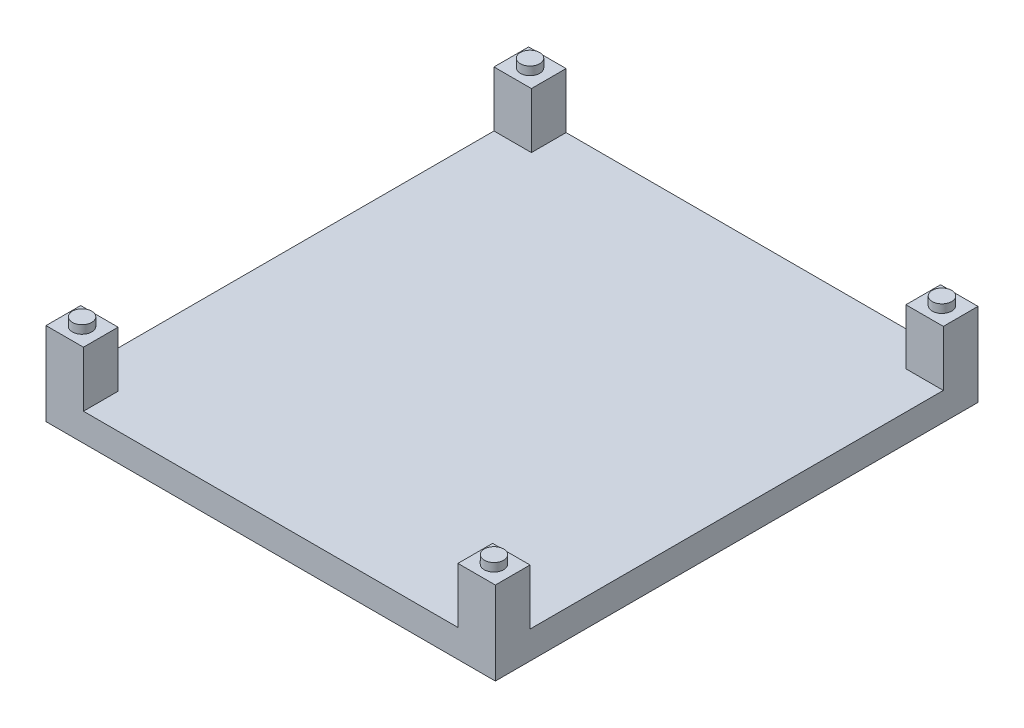
from build123d import *

# Parameters (mm, degrees)
SKETCH2_R             = 1.778
BOSS_EXTRUDE2_DEPTH   = 16.764
BOSS_EXTRUDE2_2_DEPTH = 16.764
BOSS_EXTRUDE2_3_DEPTH = 16.764
BOSS_EXTRUDE2_4_DEPTH = 16.764
SKETCH2_4_W           = 82.296
SKETCH2_4_H           = 88.392
BOSS_EXTRUDE3_DEPTH   = 5.08
SKETCH5_W             = 6.858
SKETCH5_H             = 6.35
BOSS_EXTRUDE4_DEPTH   = 10.16


with BuildPart() as part:
    # Sketch2 → Boss-Extrude2 (new body)
    with BuildSketch(Plane(origin=(0, 0, 0), x_dir=(1, 0, 0), z_dir=(0, 1, 0))):
        with Locations((37.719, -41.021)):
            Circle(SKETCH2_R)
    extrude(amount=BOSS_EXTRUDE2_DEPTH)



with BuildPart() as body_2:
    # Sketch2 → Boss-Extrude2 2 (new body)
    with BuildSketch(Plane(origin=(0, 0, 0), x_dir=(1, 0, 0), z_dir=(0, 1, 0))):
        with Locations((-37.719, -41.021)):
            Circle(SKETCH2_R)
    extrude(amount=BOSS_EXTRUDE2_2_DEPTH)


with BuildPart() as body_3:
    # Sketch2 → Boss-Extrude2 3 (new body)
    with BuildSketch(Plane(origin=(0, 0, 0), x_dir=(1, 0, 0), z_dir=(0, 1, 0))):
        with Locations((37.719, 41.021)):
            Circle(SKETCH2_R)
    extrude(amount=BOSS_EXTRUDE2_3_DEPTH)


with BuildPart() as body_4:
    # Sketch2 → Boss-Extrude2 4 (new body)
    with BuildSketch(Plane(origin=(0, 0, 0), x_dir=(1, 0, 0), z_dir=(0, 1, 0))):
        with Locations((-37.719, 41.021)):
            Circle(SKETCH2_R)
    extrude(amount=BOSS_EXTRUDE2_4_DEPTH)


with BuildPart() as part_1:
    add(part.part)

    add(body_2.part)  # Boss-Extrude3 merges body 2

    add(body_3.part)  # Boss-Extrude3 merges body 3

    add(body_4.part)  # Boss-Extrude3 merges body 4
    # Sketch2<4> → Boss-Extrude3 (add)
    with BuildSketch(Plane(origin=(0, 0, 0), x_dir=(1, 0, 0), z_dir=(0, 1, 0))):
        Rectangle(SKETCH2_4_W, SKETCH2_4_H)
    extrude(amount=BOSS_EXTRUDE3_DEPTH)

    # Sketch5 → Boss-Extrude4 (add)
    with BuildSketch(Plane(origin=(0, 5.08, 0), x_dir=(1, 0, 0), z_dir=(0, 1, 0))):
        with Locations((-37.719, 41.021)):
            Rectangle(SKETCH5_W, SKETCH5_H)
        with Locations((37.719, -41.021)):
            Rectangle(SKETCH5_W, SKETCH5_H)
        with Locations((-37.719, -41.021)):
            Rectangle(SKETCH5_W, SKETCH5_H)
        with Locations((37.719, 41.021)):
            Rectangle(SKETCH5_W, SKETCH5_H)
    extrude(amount=BOSS_EXTRUDE4_DEPTH)


solid = part_1.part
